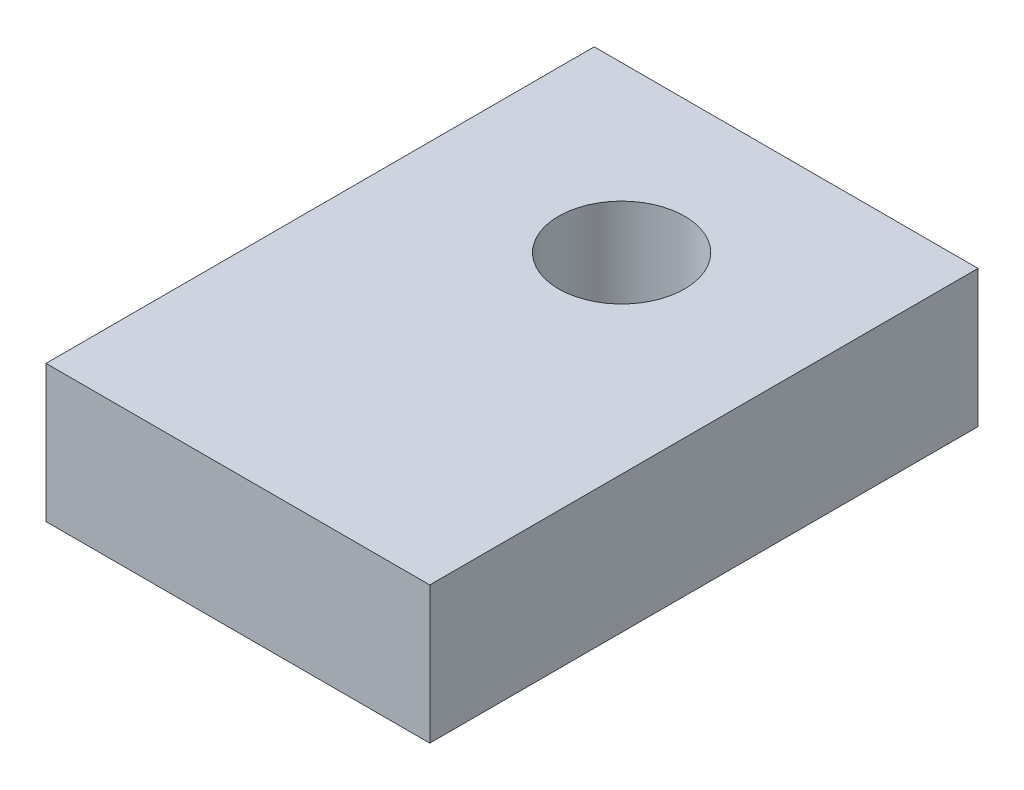
from build123d import *

# Parameters (mm, degrees)
SKETCH1_W           = 8.89
SKETCH1_H           = 12.7
SKETCH1_R           = 1.4605
BOSS_EXTRUDE1_DEPTH = 3.175


with BuildPart() as part:
    # Sketch1 → Boss-Extrude1 (new body)
    with BuildSketch(Plane(origin=(0, 0, 0), x_dir=(1, 0, 0), z_dir=(0, 1, 0))):
        with Locations((4.445, 6.35)):
            Rectangle(SKETCH1_W, SKETCH1_H)
        with Locations(Location((4.445, 8.89, 0), (0, 0, 270))):
            Circle(SKETCH1_R, mode=Mode.SUBTRACT)
    extrude(amount=BOSS_EXTRUDE1_DEPTH)


solid = part.part
